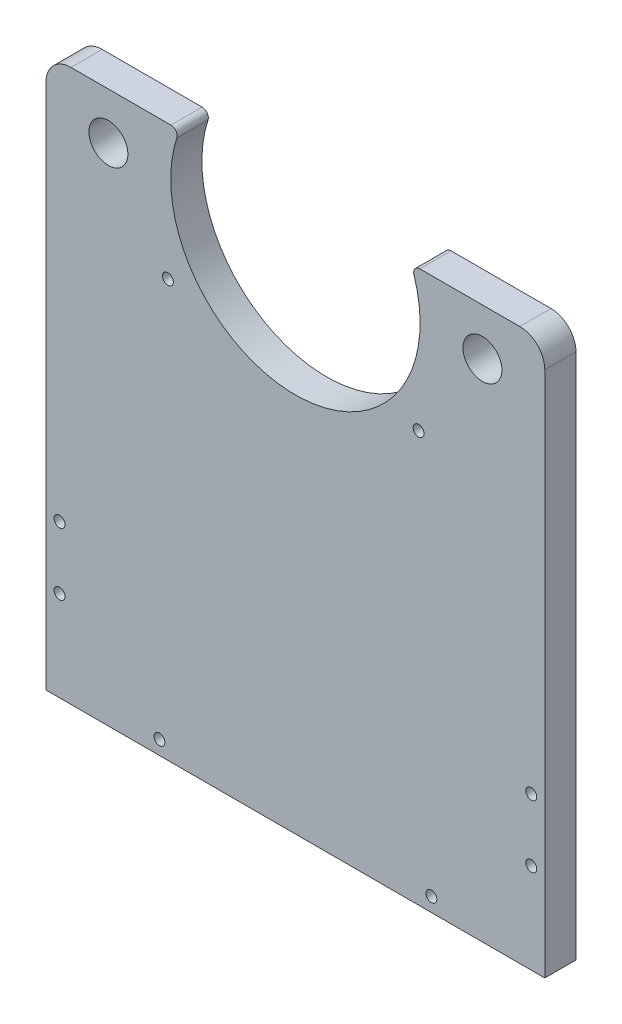
from build123d import *

# Parameters (mm, degrees)
SKETCH1_R           = 6.25
SKETCH1_R_2         = 1.75
BOSS_EXTRUDE1_DEPTH = 10
SKETCH11_R          = 1.75
CUT_EXTRUDE2_DEPTH  = 10


with BuildPart() as part:
    # Sketch1 → Boss-Extrude1 (new body)
    with BuildSketch(Plane.XY):
        with BuildLine():
            Line((0, 0), (40, 0))
            Line((40, 0), (120, 0))
            Line((120, 0), (160, 0))
            Line((160, 0), (160, 169))
            ThreePointArc((160, 169), (157.656854249, 174.656854249), (152, 177))
            Line((152, 177), (120, 177))
            Line((120, 177), (119.937451095, 177))
            ThreePointArc((119.937451095, 177), (118.319103908, 176.175139303), (118.03566771, 174.380952381))
            ThreePointArc((118.03566771, 174.380952381), (80, 122), (41.96433229, 174.380952381))
            ThreePointArc((41.96433229, 174.380952381), (41.680896092, 176.175139303), (40.062548905, 177))
            Line((40.062548905, 177), (40, 177))
            Line((40, 177), (8, 177))
            ThreePointArc((8, 177), (2.343145751, 174.656854249), (0, 169))
            Line((0, 169), (0, 0))
        make_face()
        with Locations((20, 162)):
            Circle(SKETCH1_R, mode=Mode.SUBTRACT)
        with Locations((140, 162)):
            Circle(SKETCH1_R, mode=Mode.SUBTRACT)
        with Locations((4.328403696, 49)):
            Circle(SKETCH1_R_2, mode=Mode.SUBTRACT)
        with Locations((4.328403696, 29)):
            Circle(SKETCH1_R_2, mode=Mode.SUBTRACT)
        with Locations((36.371302772, 4.5)):
            Circle(SKETCH1_R_2, mode=Mode.SUBTRACT)
        with Locations((123.628697228, 4.5)):
            Circle(SKETCH1_R_2, mode=Mode.SUBTRACT)
        with Locations((155.671596304, 29)):
            Circle(SKETCH1_R_2, mode=Mode.SUBTRACT)
        with Locations((155.671596304, 49)):
            Circle(SKETCH1_R_2, mode=Mode.SUBTRACT)
    extrude(amount=BOSS_EXTRUDE1_DEPTH)

    # Sketch11 → Cut-Extrude2 (cut)
    with BuildSketch(Plane(origin=(0, 0, 0), x_dir=(-1, 0, 0), z_dir=(0, 0, -1))):
        with Locations((-119.515447903, 131.8119911)):
            Circle(SKETCH11_R)
        with Locations((-39.078552479, 133.747183554)):
            Circle(SKETCH11_R)
    extrude(amount=-CUT_EXTRUDE2_DEPTH, mode=Mode.SUBTRACT)


solid = part.part
